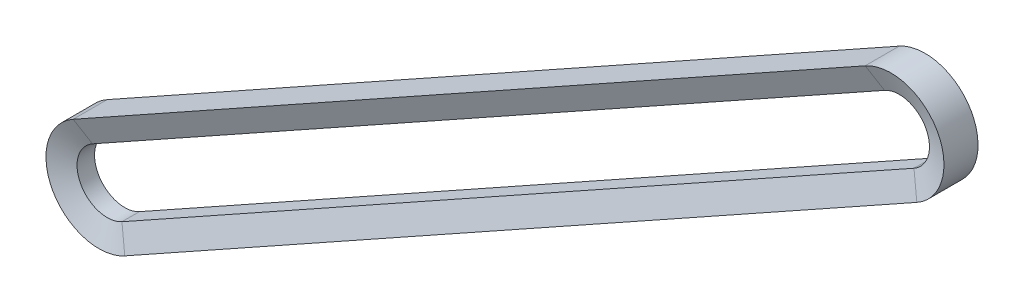
from build123d import *


with BuildPart() as part:
    # 扫描1: sweep along a path in 草图2
    with BuildLine(Plane.XY) as sweep_1_path:
        Line((2.584252226, -4.62727138), (-136.48462728, -82.294871103))
        ThreePointArc((-136.48462728, -82.294871103), (-143.696150887, -80.251851948), (-141.653131732, -73.040328341))
        Line((-141.653131732, -73.040328341), (-2.584252225, 4.627271382))
        ThreePointArc((-2.584252225, 4.627271382), (4.627271381, 2.584252227), (2.584252226, -4.62727138))
    # 草图3 → 扫描1 (sweep)
    with BuildSketch(Plane(origin=(0, 0, 0), x_dir=(0, 0, -1), z_dir=(0.8730700718754512, 0.48759475960616566, 0))):
        Polygon((-1.535, 5.3), (1.535, 5.3), (2.990880937, 9.3), (-2.990880937, 9.3), align=None)
    sweep(path=sweep_1_path.line)


solid = part.part
